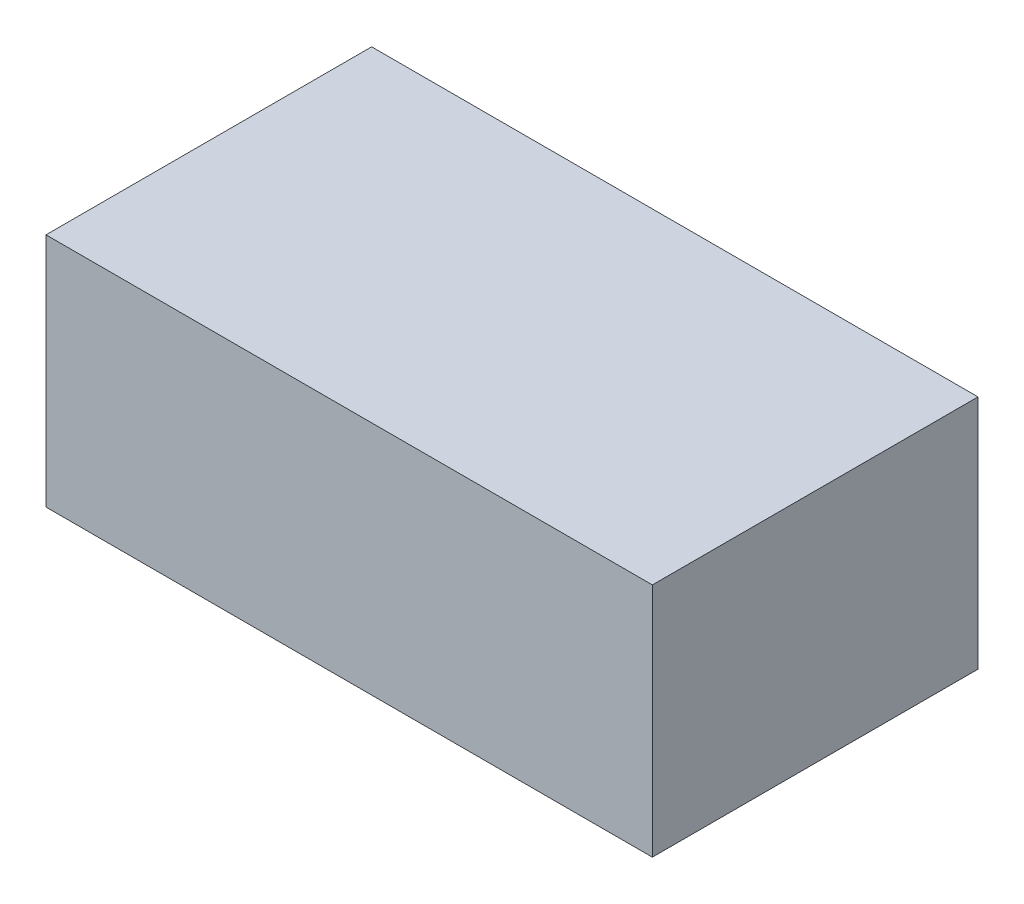
from build123d import *

# Parameters (mm, degrees)
SKETCH1_W           = 54
SKETCH1_H           = 29
BOSS_EXTRUDE1_DEPTH = 21


with BuildPart() as part:
    # Sketch1 → Boss-Extrude1 (new body)
    with BuildSketch(Plane(origin=(0, 0, 0), x_dir=(1, 0, 0), z_dir=(0, 1, 0))):
        with Locations((27, 14.5)):
            Rectangle(SKETCH1_W, SKETCH1_H)
    extrude(amount=BOSS_EXTRUDE1_DEPTH)


solid = part.part
